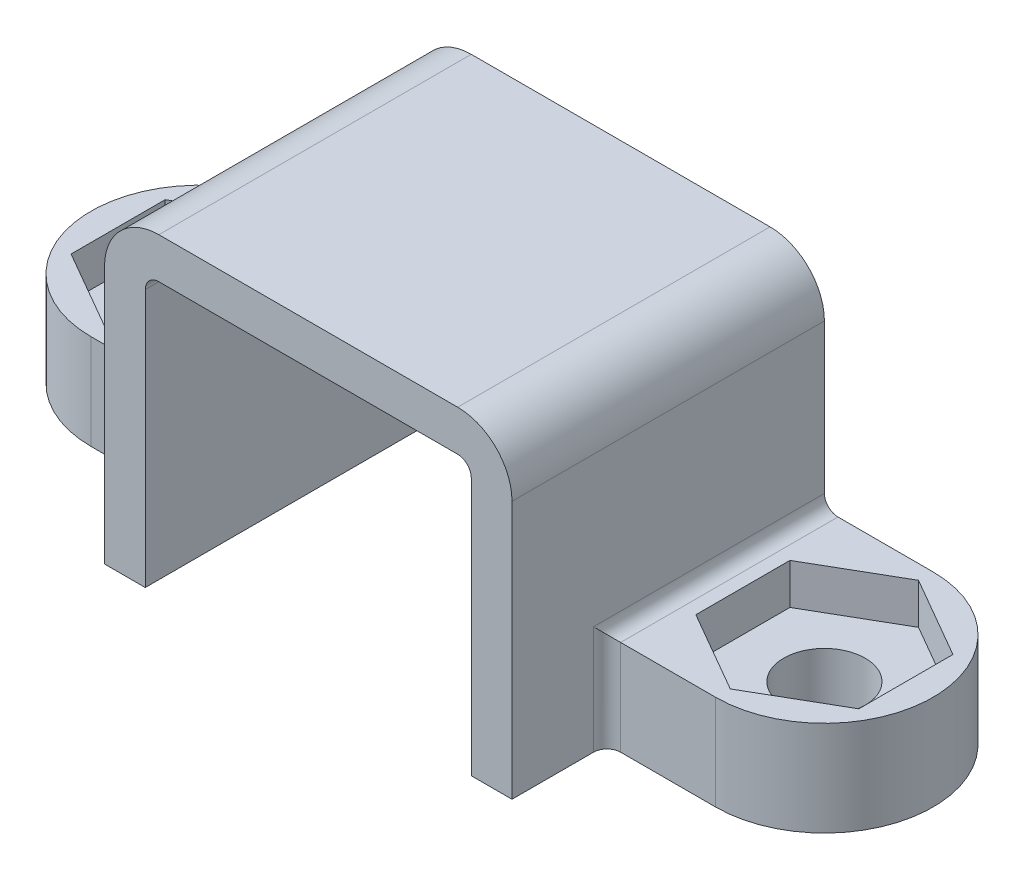
from build123d import *

# Parameters (mm, degrees)
SKETCH1_W           = 15
SKETCH1_H           = 11.5
BOSS_EXTRUDE1_DEPTH = 1.5
SKETCH4_W           = 1.5
SKETCH4_H           = 11.5
BOSS_EXTRUDE2_DEPTH = 10
BOSS_EXTRUDE3_DEPTH = 3.5
CUT_EXTRUDE1_DEPTH  = 1.5
SKETCH12_R          = 1.5
CUT_EXTRUDE3_DEPTH  = 19.366069258
FILLET1_R           = 2
FILLET2_R           = 0.5


with BuildPart() as part:
    # Sketch1 → Boss-Extrude1 (new body)
    with BuildSketch(Plane(origin=(0, 0, 0), x_dir=(1, 0, 0), z_dir=(0, 1, 0))):
        Rectangle(SKETCH1_W, SKETCH1_H)
    extrude(amount=BOSS_EXTRUDE1_DEPTH)

    # Sketch4 → Boss-Extrude2 (add)
    with BuildSketch(Plane.XZ):
        with Locations((-6.75, 0)):
            Rectangle(SKETCH4_W, SKETCH4_H)
        with Locations((6.75, 0)):
            Rectangle(SKETCH4_W, SKETCH4_H)
    extrude(amount=BOSS_EXTRUDE2_DEPTH)

    # Sketch5 → Boss-Extrude3 (add)
    with BuildSketch(Plane.XZ.offset(10)):
        with BuildLine():
            Line((-6, -5.75), (-11.5, -5.75))
            ThreePointArc((-11.5, -5.75), (-15.5, -1.75), (-11.5, 2.25))
            Line((-11.5, 2.25), (-6, 2.25))
            Line((-6, 2.25), (-6, -5.75))
        make_face()
        with BuildLine():
            Line((6, -5.75), (11.5, -5.75))
            ThreePointArc((11.5, -5.75), (15.5, -1.75), (11.5, 2.25))
            Line((11.5, 2.25), (6, 2.25))
            Line((6, 2.25), (6, -5.75))
        make_face()
    extrude(amount=-BOSS_EXTRUDE3_DEPTH)

    # Sketch10 → Cut-Extrude1 (cut)
    with BuildSketch(Plane(origin=(0, -6.5, 0), x_dir=(1, 0, 0), z_dir=(0, 1, 0))):
        Polygon((-8.5, 3.482050808), (-11.5, 5.214101615), (-14.5, 3.482050808), (-14.5, 0.017949192), (-11.5, -1.714101615), (-8.5, 0.017949192), align=None)
    cut_extrude1 = extrude(amount=-CUT_EXTRUDE1_DEPTH, mode=Mode.SUBTRACT)

    # Sketch12 → Cut-Extrude3 (cut, through all)
    with BuildSketch(Plane(origin=(0, -6.5, 0), x_dir=(1, 0, 0), z_dir=(0, 1, 0))):
        with Locations(Location((-11.5, 1.75, 0), (0, 0, 270))):
            Circle(SKETCH12_R)
    cut_extrude3 = extrude(amount=-CUT_EXTRUDE3_DEPTH, mode=Mode.SUBTRACT)

    # Mirror1: Cut-Extrude1, Cut-Extrude3 across plane
    add(cut_extrude1.mirror(Plane(origin=(0, 0, 0), x_dir=(0, 0, 1), z_dir=(1, 0, 0))), mode=Mode.SUBTRACT)
    add(cut_extrude3.mirror(Plane(origin=(0, 0, 0), x_dir=(0, 0, 1), z_dir=(1, 0, 0))), mode=Mode.SUBTRACT)

    # Fillet1
    fillet1_edges = [part.edges().sort_by_distance(p)[0] for p in [
        (7.5, 1.5, 0),
        (-7.5, 1.5, 0),
    ]]
    fillet(fillet1_edges, radius=FILLET1_R)

    # Fillet2
    fillet2_edges = [part.edges().sort_by_distance(p)[0] for p in [
        (-6, 0, 0),
        (6, 0, 0),
        (-7.5, -6.5, -1.75),
        (-7.5, -8.25, 2.25),
        (7.5, -8.25, 2.25),
        (7.5, -6.5, -1.75),
    ]]
    fillet(fillet2_edges, radius=FILLET2_R)


solid = part.part
